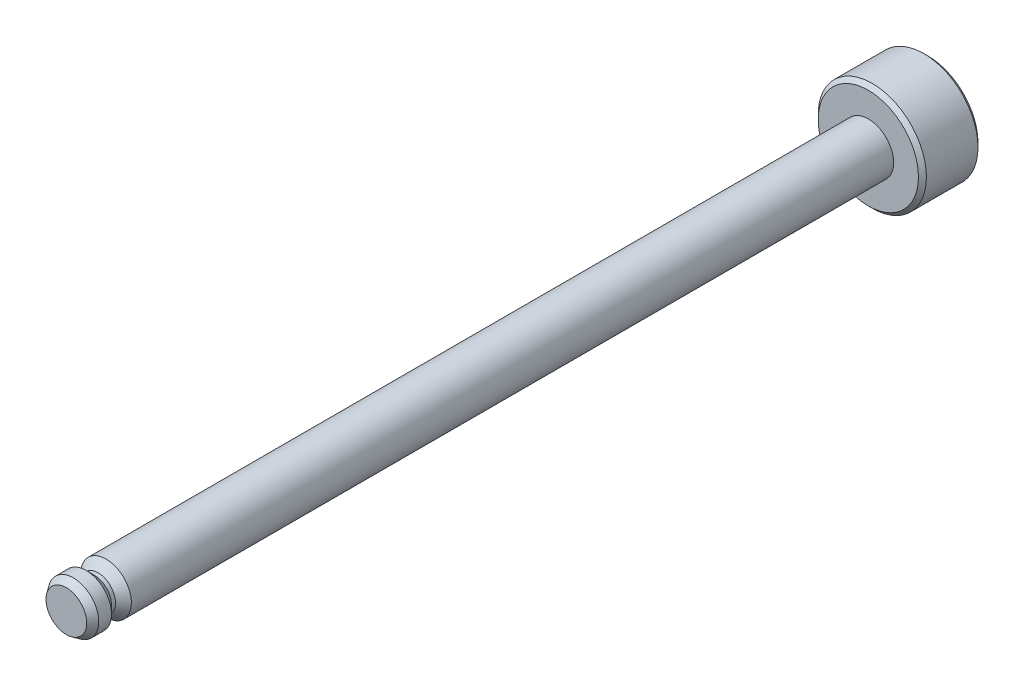
from build123d import *

# Parameters (mm, degrees)
SKETCH2_R      = 1.275
SHAFT_DEPTH    = 40.4
SKETCH5_R      = 2.725
HEAD_DEPTH     = 3
CHAMFER1_SIZE  = 0.25
CHAMFER1_SIZE2 = 0.357037002
DEBURS_SIZE    = 0.2


with BuildPart() as part:
    # Sketch2 → Shaft (new body)
    with BuildSketch(Plane.XY):
        Circle(SKETCH2_R)
    extrude(amount=SHAFT_DEPTH)

    # Sketch5 → Head (add)
    with BuildSketch(Plane.XY):
        Circle(SKETCH5_R)
    extrude(amount=-HEAD_DEPTH)

    # Chamfer1
    chamfer1_edges = [part.edges().sort_by_distance(p)[0] for p in [
        (-1.275, 0, 40.4),
    ]]
    chamfer1_side = [part.faces().sort_by_distance(p)[0] for p in [
        (0, 0, 40.4),
    ]]
    chamfer(chamfer1_edges, length=CHAMFER1_SIZE, length2=CHAMFER1_SIZE2, reference=chamfer1_side[0])

    # Deburs
    deburs_edges = [part.edges().sort_by_distance(p)[0] for p in [
        (-2.725, 0, -3),
        (-2.725, 0, 0),
    ]]
    chamfer(deburs_edges, length=DEBURS_SIZE)

    # Sketch6 → e-Clip Notch Long (revolve, cut)
    with BuildSketch(Plane(origin=(0, 0, 0), x_dir=(0, 0, -1), z_dir=(1, 0, 0))):
        Polygon((-39.4, 1.275), (-38.4, 1.275), (-38.8, 0.875), (-39, 0.875), align=None)
    revolve(axis=Axis((0, 0, 0), (0, 0, 1)), mode=Mode.SUBTRACT)


solid = part.part
